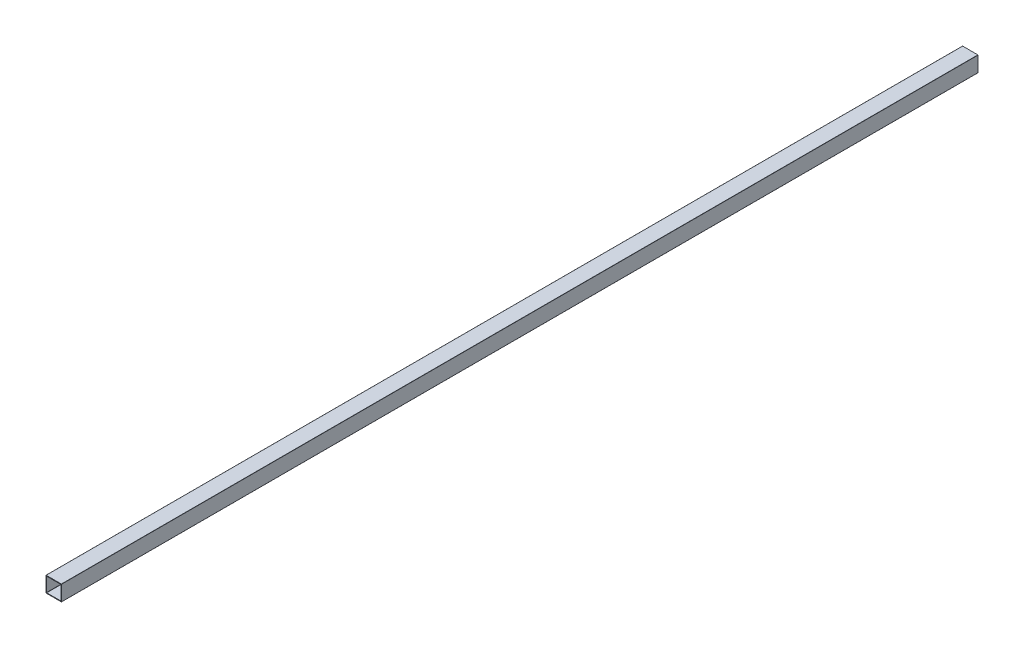
from build123d import *

# Parameters (mm, degrees)
CROQUIS1_W              = 101.6
CROQUIS1_H              = 101.6
CROQUIS1_W_2            = 94
CROQUIS1_H_2            = 94
SALIENTE_EXTRUIR1_DEPTH = 6000
REDONDEO1_R             = 1


with BuildPart() as part:
    # Croquis1 → Saliente-Extruir1 (new body)
    with BuildSketch(Plane.XY):
        Rectangle(CROQUIS1_W, CROQUIS1_H)
        Rectangle(CROQUIS1_W_2, CROQUIS1_H_2, mode=Mode.SUBTRACT)
    extrude(amount=-SALIENTE_EXTRUIR1_DEPTH)

    # Redondeo1
    redondeo1_edges = [part.edges().sort_by_distance(p)[0] for p in [
        (47, -47, -3000),
        (-47, -47, -3000),
        (-47, 47, -3000),
        (47, 47, -3000),
        (50.8, -50.8, -3000),
        (-50.8, -50.8, -3000),
        (-50.8, 50.8, -3000),
        (50.8, 50.8, -3000),
    ]]
    fillet(redondeo1_edges, radius=REDONDEO1_R)


solid = part.part
